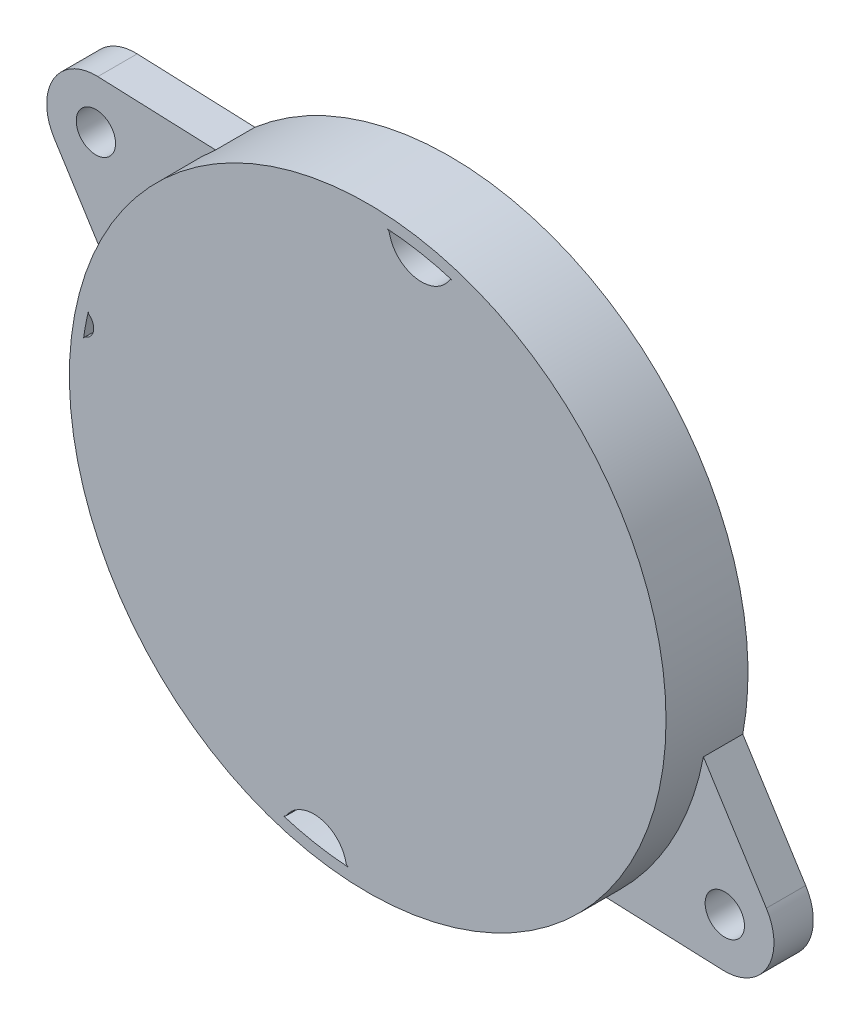
from build123d import *

# Parameters (mm, degrees)
SKETCH4_R           = 18.2
BOSS_EXTRUDE3_DEPTH = 5
CUT_EXTRUDE2_DEPTH  = 2
SKETCH6_R           = 1.2
BOSS_EXTRUDE4_DEPTH = 2.4
SKETCH1_R           = 8.25
CUT_EXTRUDE1_DEPTH  = 0.2
SKETCH2_R           = 8
BOSS_EXTRUDE1_DEPTH = 1.7
SKETCH3_R           = 1.25
BOSS_EXTRUDE2_DEPTH = 4.5
CHAMFER1_SIZE       = 0.2
CHAMFER2_SIZE       = 0.2


with BuildPart() as part:
    # Sketch4 → Boss-Extrude3 (new body)
    with BuildSketch(Plane.XY):
        Circle(SKETCH4_R)
    extrude(amount=BOSS_EXTRUDE3_DEPTH)

    # Sketch5 → Cut-Extrude2 (cut)
    with BuildSketch(Plane.XY.offset(5)):
        with BuildLine():
            ThreePointArc((1.322526628, 17.302811533), (2.918295178, 15.731610002), (4.971429117, 16.625921213))
            ThreePointArc((4.971429117, 16.625921213), (5.071370491, 16.706466919), (5.199688837, 16.709674922))
            ThreePointArc((5.199688837, 16.709674922), (3.191885351, 17.20644844), (1.139493871, 17.462862128))
            ThreePointArc((1.139493871, 17.462862128), (1.258123981, 17.413843908), (1.322526628, 17.302811533))
        make_face()
        with BuildLine():
            ThreePointArc((-17.208763457, 2.536145077), (-16.729701345, 3.103446294), (-16.97341649, 3.804826439))
            ThreePointArc((-16.97341649, 3.804826439), (-17.032179911, 3.894218363), (-17.036464522, 4.001109419))
            ThreePointArc((-17.036464522, 4.001109419), (-17.20644844, 3.191885351), (-17.338016995, 2.375535034))
            ThreePointArc((-17.338016995, 2.375535034), (-17.295679076, 2.473777369), (-17.208763457, 2.536145077))
        make_face()
        with BuildLine():
            ThreePointArc((-5.199688837, -16.709674922), (-3.191885351, -17.20644844), (-1.139493871, -17.462862128))
            ThreePointArc((-1.139493871, -17.462862128), (-1.258123981, -17.413843908), (-1.322526628, -17.302811533))
            ThreePointArc((-1.322526628, -17.302811533), (-2.918295178, -15.731610002), (-4.971429117, -16.625921213))
            ThreePointArc((-4.971429117, -16.625921213), (-5.071370491, -16.706466919), (-5.199688837, -16.709674922))
        make_face()
    extrude(amount=-CUT_EXTRUDE2_DEPTH, mode=Mode.SUBTRACT)

    # Sketch6 → Boss-Extrude4 (add)
    # profile 1 of 2: a face of its own
    with BuildSketch(Plane.XY):
        with BuildLine():
            Line((-19.06335062, 14.072551336), (-11.880431968, 13.787506527))
            ThreePointArc((-11.880431968, 13.787506527), (-15.761662349, 9.1), (-17.880546892, 3.395002629))
            Line((-17.880546892, 3.395002629), (-21.718862263, 9.47307025))
            ThreePointArc((-21.718862263, 9.47307025), (-21.78038431, 12.574910744), (-19.06335062, 14.072551336))
        make_face()
        with Locations((-19.182308099, 11.074910744)):
            Circle(SKETCH6_R, mode=Mode.SUBTRACT)
    # profile 2 of 2: a face of its own
    with BuildSketch(Plane.XY):
        with BuildLine():
            Line((17.880546892, -3.395002629), (21.718862263, -9.47307025))
            ThreePointArc((21.718862263, -9.47307025), (21.78038431, -12.574910744), (19.06335062, -14.072551336))
            Line((19.06335062, -14.072551336), (11.880431968, -13.787506527))
            ThreePointArc((11.880431968, -13.787506527), (15.761662349, -9.1), (17.880546892, -3.395002629))
        make_face()
        with Locations((19.182308099, -11.074910744)):
            Circle(SKETCH6_R, mode=Mode.SUBTRACT)
    extrude(amount=BOSS_EXTRUDE4_DEPTH)

    # Sketch1 → Cut-Extrude1 (cut)
    with BuildSketch(Plane(origin=(0, 0, 0), x_dir=(-1, 0, 0), z_dir=(0, 0, -1))):
        with Locations(Location((0, 0, 0), (0, 0, 180))):
            Circle(SKETCH1_R)
    extrude(amount=-CUT_EXTRUDE1_DEPTH, mode=Mode.SUBTRACT)

    # Sketch2 → Boss-Extrude1 (add)
    with BuildSketch(Plane(origin=(0, 0, 0.2), x_dir=(-1, 0, 0), z_dir=(0, 0, -1))):
        with Locations(Location((0, 0, 0), (0, 0, 180))):
            Circle(SKETCH2_R)
    extrude(amount=BOSS_EXTRUDE1_DEPTH)

    # Sketch3 → Boss-Extrude2 (add)
    with BuildSketch(Plane(origin=(0, 0, -1.5), x_dir=(-1, 0, 0), z_dir=(0, 0, -1))):
        Circle(SKETCH3_R)
    extrude(amount=BOSS_EXTRUDE2_DEPTH)

    # Chamfer1
    chamfer1_edges = [part.edges().sort_by_distance(p)[0] for p in [
        (1.25, 0, -6),
    ]]
    chamfer(chamfer1_edges, length=CHAMFER1_SIZE)

    # Chamfer2
    chamfer2_edges = [part.edges().sort_by_distance(p)[0] for p in [
        (-8, 0, -1.5),
    ]]
    chamfer(chamfer2_edges, length=CHAMFER2_SIZE)


solid = part.part
